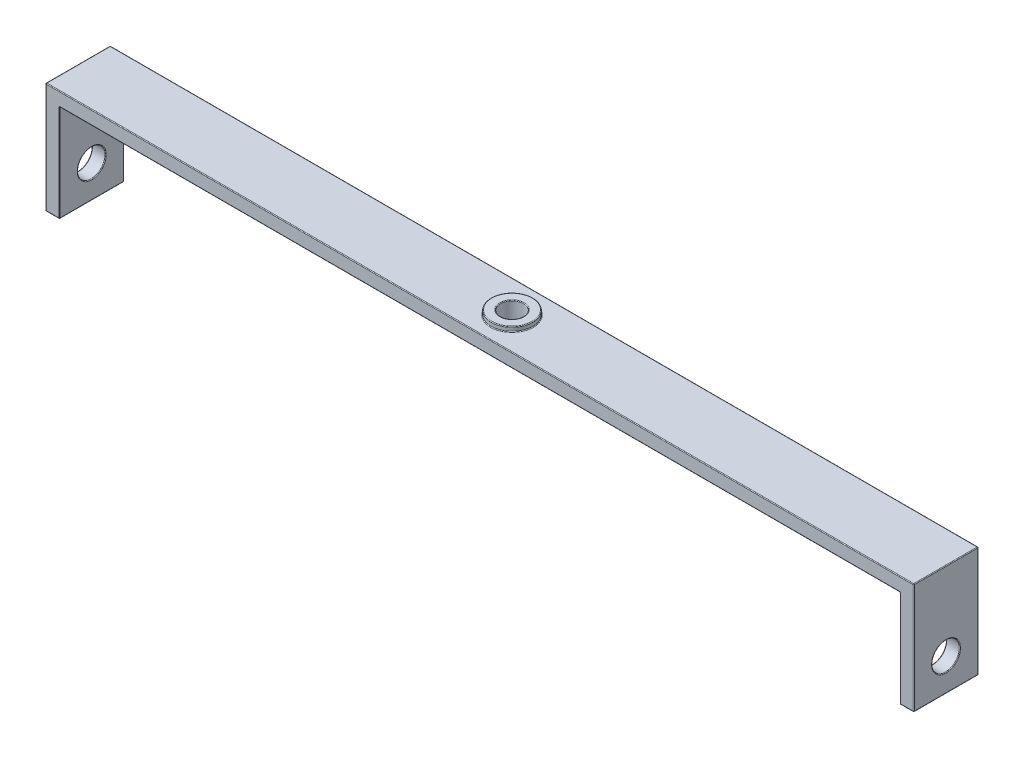
from build123d import *

# Parameters (mm, degrees)
BOSS_EXTRUDE1_DEPTH      = 3.5
BOSS_EXTRUDE1_DEPTH_BACK = 3.5
SKETCH2_R                = 1.25
CUT_EXTRUDE1_DEPTH       = 3.5
BOSS_EXTRUDE2_START      = 0.5
SKETCH3_R                = 2.25
SKETCH3_R_2              = 1.25
BOSS_EXTRUDE2_DEPTH      = 0.5
SKETCH5_R                = 1.5
CUT_EXTRUDE2_DEPTH       = 99.5
FILLET1_R                = 0.075


with BuildPart() as part:
    # Sketch1 → Boss-Extrude1 (new, two sides: drawn at the far end of the back side and taken through both)
    with BuildSketch(Plane.XY.offset(-BOSS_EXTRUDE1_DEPTH_BACK)):
        Polygon((-47, 0), (47, 0), (47, -12), (45.5, -12), (45.5, -1.5), (-45.5, -1.5), (-45.5, -12), (-47, -12), align=None)
    extrude(amount=BOSS_EXTRUDE1_DEPTH + BOSS_EXTRUDE1_DEPTH_BACK)

    # Sketch2 → Cut-Extrude1 (cut)
    with BuildSketch(Plane(origin=(0, 0, 0), x_dir=(1, 0, 0), z_dir=(0, 1, 0))):
        Circle(SKETCH2_R)
    extrude(amount=-CUT_EXTRUDE1_DEPTH, mode=Mode.SUBTRACT)

    # Sketch3 → Boss-Extrude2 (add)
    with BuildSketch(Plane(origin=(0, 0, 0), x_dir=(1, 0, 0), z_dir=(0, 1, 0)).offset(BOSS_EXTRUDE2_START)):
        Circle(SKETCH3_R)
        Circle(SKETCH3_R_2, mode=Mode.SUBTRACT)
    extrude(amount=-BOSS_EXTRUDE2_DEPTH)

    # Sketch5 → Cut-Extrude2 (cut)
    with BuildSketch(Plane.ZY.offset(47)):
        with Locations((0, -8.5)):
            Circle(SKETCH5_R)
    extrude(amount=-CUT_EXTRUDE2_DEPTH, mode=Mode.SUBTRACT)

    # Fillet1
    fillet1_edges = [part.edges().sort_by_distance(p)[0] for p in [
        (-47, -8.5, -1.5),
        (-45.5, -8.5, -1.5),
        (45.5, -8.5, -1.5),
        (47, -8.5, -1.5),
        (-1.25, 0.5, 0),
        (-2.25, 0, 0),
        (-2.25, 0.5, 0),
        (-1.25, -1.5, 0),
        (-47, -6, 3.5),
        (-46.25, -12, 3.5),
        (-45.5, -6.75, 3.5),
        (0, -1.5, 3.5),
        (45.5, -6.75, 3.5),
        (46.25, -12, 3.5),
        (47, -6, 3.5),
        (0, 0, 3.5),
        (-47, -6, -3.5),
        (-46.25, -12, -3.5),
        (-45.5, -6.75, -3.5),
        (0, -1.5, -3.5),
        (45.5, -6.75, -3.5),
        (46.25, -12, -3.5),
        (47, -6, -3.5),
        (0, 0, -3.5),
        (-47, -12, 0),
        (-45.5, -12, 0),
        (-45.5, -1.5, 0),
        (45.5, -1.5, 0),
        (45.5, -12, 0),
        (47, -12, 0),
        (47, 0, 0),
        (-47, 0, 0),
    ]]
    fillet(fillet1_edges, radius=FILLET1_R)


solid = part.part
